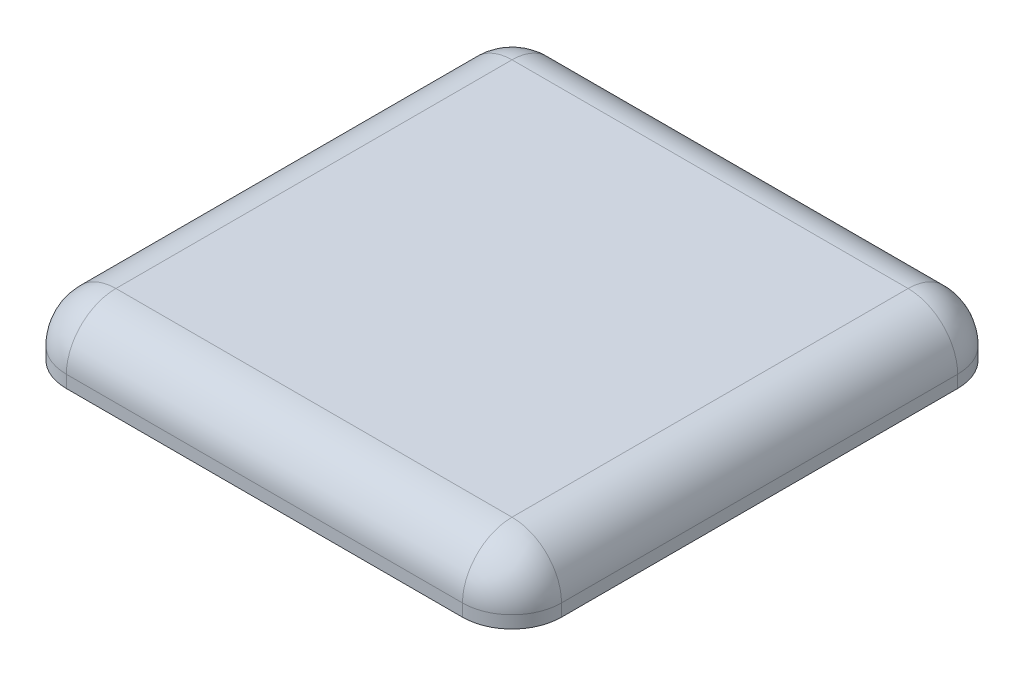
from build123d import *

# Parameters (mm, degrees)
SKETCH1_W           = 20
SKETCH1_H           = 20
BOSS_EXTRUDE1_DEPTH = 2.5
BOSS_EXTRUDE2_DEPTH = 6
SKETCH3_W           = 2
SKETCH3_H           = 5
BOSS_EXTRUDE3_DEPTH = 3
FILLET1_R           = 2


with BuildPart() as part:
    # Sketch1 → Boss-Extrude1 (new body)
    with BuildSketch(Plane(origin=(0, 2.5, 0), x_dir=(1, 0, 0), z_dir=(0, 1, 0))):
        Rectangle(SKETCH1_W, SKETCH1_H)
    extrude(amount=-BOSS_EXTRUDE1_DEPTH)

    # Sketch2 → Boss-Extrude2 (add)
    with BuildSketch(Plane.XZ):
        with BuildLine():
            Line((-2.015564435, 1.000000009), (-1.000000005, 1.000000009))
            Line((-1.000000005, 1.000000009), (-1.000000005, 2.015564439))
            ThreePointArc((-1.000000005, 2.015564439), (0, 2.250000005), (1.000000005, 2.015564439))
            Line((1.000000005, 2.015564439), (1.000000005, 1.000000009))
            Line((1.000000005, 1.000000009), (2.015564435, 1.000000009))
            ThreePointArc((2.015564435, 1.000000009), (2.25, 5e-09), (2.015564435, -1))
            Line((2.015564435, -1), (1.000000005, -1))
            Line((1.000000005, -1), (1.000000005, -2.01556443))
            ThreePointArc((1.000000005, -2.01556443), (0, -2.249999995), (-1.000000005, -2.01556443))
            Line((-1.000000005, -2.01556443), (-1.000000005, -1))
            Line((-1.000000005, -1), (-2.015564435, -1))
            ThreePointArc((-2.015564435, -1), (-2.25, 5e-09), (-2.015564435, 1.000000009))
        make_face()
    extrude(amount=BOSS_EXTRUDE2_DEPTH)

    # Sketch3 → Boss-Extrude3 (add)
    with BuildSketch(Plane.XZ):
        with Locations((-8.5, 0)):
            Rectangle(SKETCH3_W, SKETCH3_H)
    extrude(amount=BOSS_EXTRUDE3_DEPTH)

    # Fillet1
    fillet1_edges = [part.edges().sort_by_distance(p)[0] for p in [
        (0, 2.5, 10),
        (-10, 2.5, 0),
        (0, 2.5, -10),
        (10, 2.5, 0),
        (10, 1.25, 10),
        (-10, 1.25, 10),
        (-10, 1.25, -10),
        (10, 1.25, -10),
    ]]
    fillet(fillet1_edges, radius=FILLET1_R)


solid = part.part
